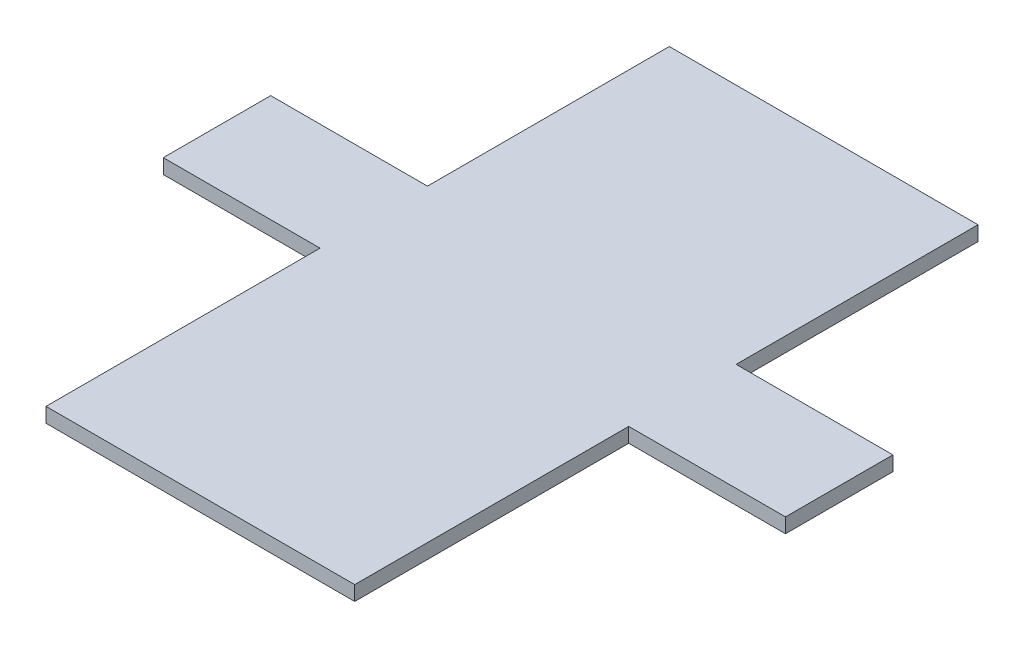
from build123d import *

# Parameters (mm, degrees)
BOSS_EXTRU_1_DEPTH = 1.87


with BuildPart() as part:
    # Esquisse1 → Boss.-Extru.1 (new body)
    with BuildSketch(Plane(origin=(0, 0, 0), x_dir=(1, 0, 0), z_dir=(0, 1, 0))):
        Polygon((0, 0), (39.43, 0), (39.43, 35), (59.45, 35), (59.45, 48.72), (39.43, 48.72), (39.43, 79.61), (0, 79.61), (0, 48.72), (-20.02, 48.72), (-20.02, 35), (0, 35), align=None)
    extrude(amount=BOSS_EXTRU_1_DEPTH)


solid = part.part
